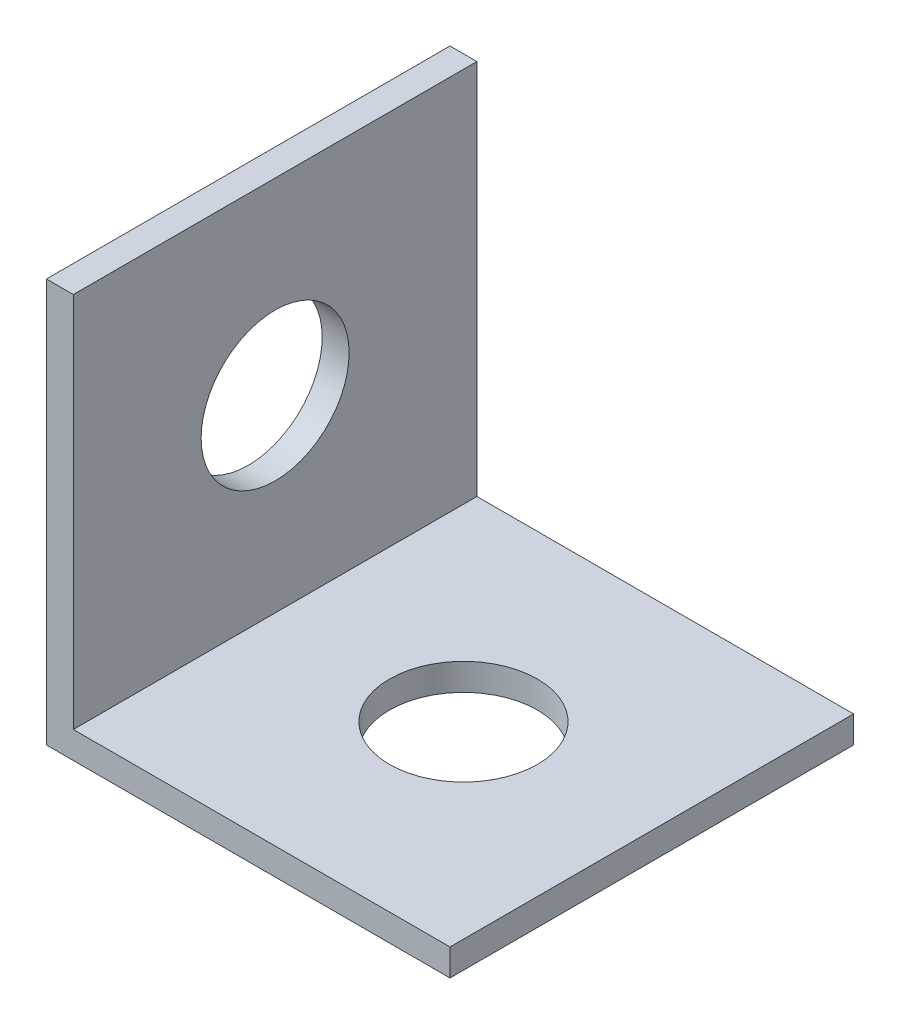
from build123d import *

# Parameters (mm, degrees)
BOSS_EXTRUDE1_DEPTH = 15
SKETCH2_R           = 2.75
CUT_EXTRUDE1_DEPTH  = 19.05
SKETCH3_R           = 2.75
CUT_EXTRUDE2_DEPTH  = 26.416530054


with BuildPart() as part:
    # Sketch1 → Boss-Extrude1 (new body)
    with BuildSketch(Plane.XY):
        Polygon((0, 0), (0, 15), (1, 15), (1, 1), (15, 1), (15, 0), align=None)
    extrude(amount=BOSS_EXTRUDE1_DEPTH)

    # Sketch2 → Cut-Extrude1 (cut)
    with BuildSketch(Plane(origin=(0, 0, 0), x_dir=(-1, 0, 0), z_dir=(0, -1, 0))):
        with Locations(Location((-8, -7.5, 0), (0, 0, 180))):
            Circle(SKETCH2_R)
    extrude(amount=-CUT_EXTRUDE1_DEPTH, mode=Mode.SUBTRACT)

    # Sketch3 → Cut-Extrude2 (cut, through all)
    with BuildSketch(Plane(origin=(1, 0, 0), x_dir=(0, 0, -1), z_dir=(1, 0, 0))):
        with Locations(Location((-7.5, 8, 0), (0, 0, 90))):
            Circle(SKETCH3_R)
    extrude(amount=-CUT_EXTRUDE2_DEPTH, mode=Mode.SUBTRACT)


solid = part.part
